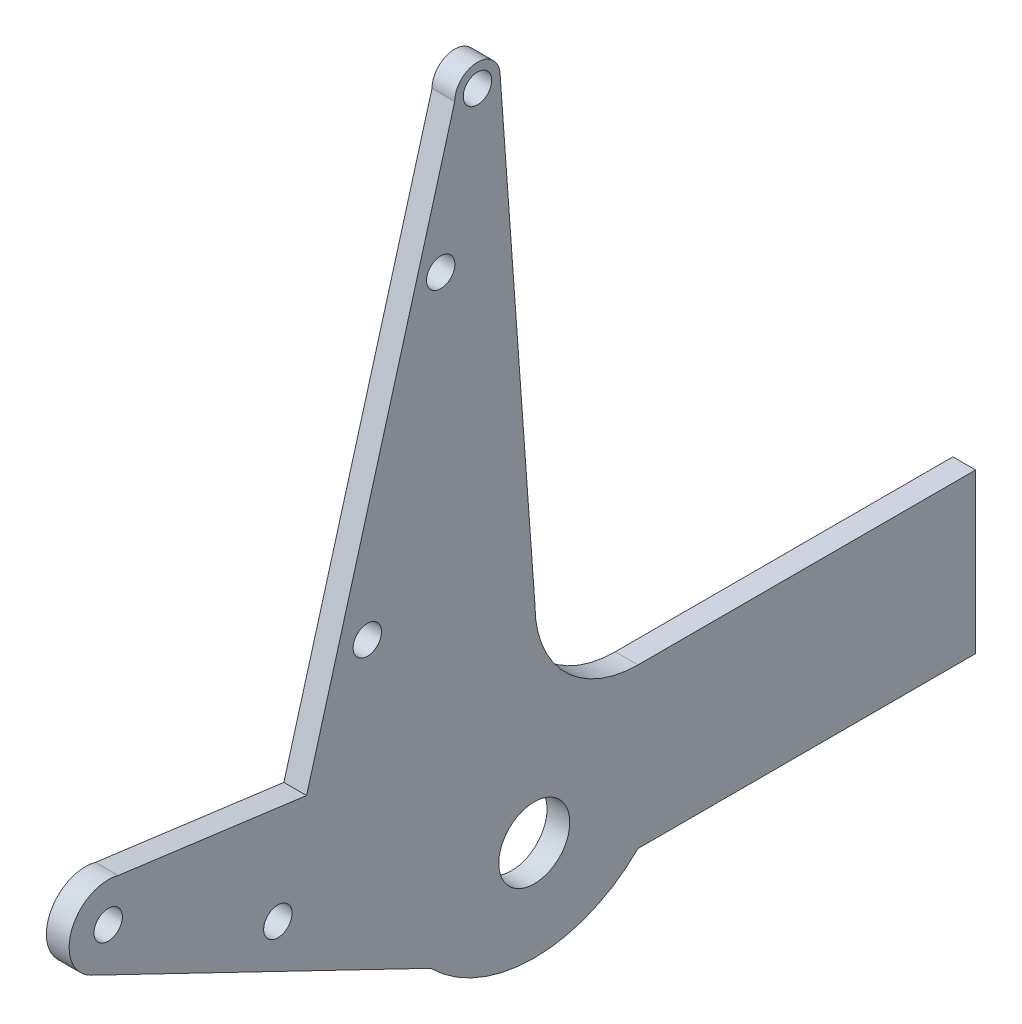
from build123d import *

# Parameters (mm, degrees)
SKETCH1_R           = 2.5
SKETCH1_R_2         = 6.25
BOSS_EXTRUDE1_DEPTH = 4
SKETCH2_W           = 4
SKETCH2_H           = 28
BOSS_EXTRUDE2_DEPTH = 1.94


with BuildPart() as part:
    # Sketch1 → Boss-Extrude1 (new body)
    with BuildSketch(Plane(origin=(0, 0, 0), x_dir=(0, 0, -1), z_dir=(1, 0, 0))):
        with BuildLine():
            ThreePointArc((-57.5, 18), (-70.338674346, 23.330913022), (-75.625323458, 36.187877429))
            Line((-75.625323458, 36.187877429), (-81.75, 120))
            ThreePointArc((-81.75, 120), (-85.75, 124), (-89.75, 120))
            Line((-89.75, 120), (-115.82263113, 27.253642352))
            Line((-115.82263113, 27.253642352), (-148.961993572, 31.638422856))
            ThreePointArc((-148.961993572, 31.638422856), (-157.193398915, 27.397547793), (-153.736313474, 18.807459581))
            Line((-153.736313474, 18.807459581), (-94, -10))
            ThreePointArc((-94, -10), (-75.75, -17.559397513), (-57.5, -10))
            Line((-57.5, -10), (0, -10))
            Line((0, -10), (0, 18))
            Line((0, 18), (-57.5, 18))
        make_face()
        with Locations((-150.75, 25)):
            Circle(SKETCH1_R, mode=Mode.SUBTRACT)
        with Locations((-120.879671399, 10.600773875)):
            Circle(SKETCH1_R, mode=Mode.SUBTRACT)
        with Locations((-75.75, 0)):
            Circle(SKETCH1_R_2, mode=Mode.SUBTRACT)
        with Locations((-105.136571318, 45.63560228)):
            Circle(SKETCH1_R, mode=Mode.SUBTRACT)
        with Locations((-92.213009764, 95.208724602)):
            Circle(SKETCH1_R, mode=Mode.SUBTRACT)
        with Locations((-85.75, 120)):
            Circle(SKETCH1_R, mode=Mode.SUBTRACT)
    extrude(amount=BOSS_EXTRUDE1_DEPTH)

    # Sketch2 → Boss-Extrude2 (add)
    with BuildSketch(Plane(origin=(0, 0, 0), x_dir=(-1, 0, 0), z_dir=(0, 0, -1))):
        with Locations((-2, 4)):
            Rectangle(SKETCH2_W, SKETCH2_H)
    extrude(amount=BOSS_EXTRUDE2_DEPTH)


solid = part.part
